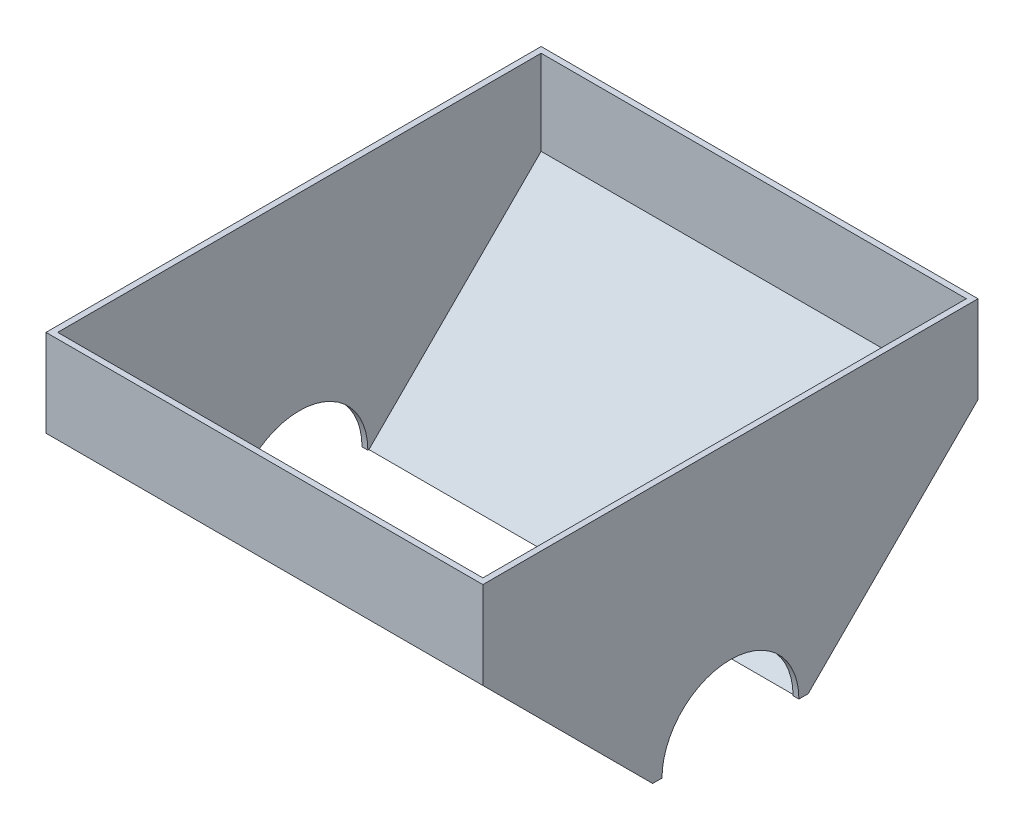
from build123d import *

# Parameters (mm, degrees)
EXTRUDE_1_DEPTH     = 75
SHELL_1_T           = -2
SKETCH_2_R          = 23.5
CUT_EXTRUDE_1_DEPTH = 194.70352352


with BuildPart() as part:
    # 草图1 → 凸台-拉伸1 (new, symmetric)
    with BuildSketch(Plane(origin=(0, 0, 0), x_dir=(0, 0, -1), z_dir=(1, 0, 0))):
        Polygon((0, 0), (85, 0), (85, -30), (26.704728189, -88.295271811), (-26.704728189, -88.295271811), (-85, -30), (-85, 0), align=None)
    extrude(amount=EXTRUDE_1_DEPTH, both=True)

    # 抽壳1
    shell_1_openings = [part.faces().sort_by_distance(p)[0] for p in [
        (0, 0, 0),
        (0, -88.295271811, 0),
    ]]
    offset(amount=SHELL_1_T, openings=shell_1_openings, kind=Kind.INTERSECTION)

    # 草图2 → 切除-拉伸1 (cut, through all)
    with BuildSketch(Plane(origin=(75, 0, 0), x_dir=(0, 0, -1), z_dir=(1, 0, 0))):
        with Locations((0, -88.295271811)):
            Circle(SKETCH_2_R)
    extrude(amount=-CUT_EXTRUDE_1_DEPTH, mode=Mode.SUBTRACT)


solid = part.part
